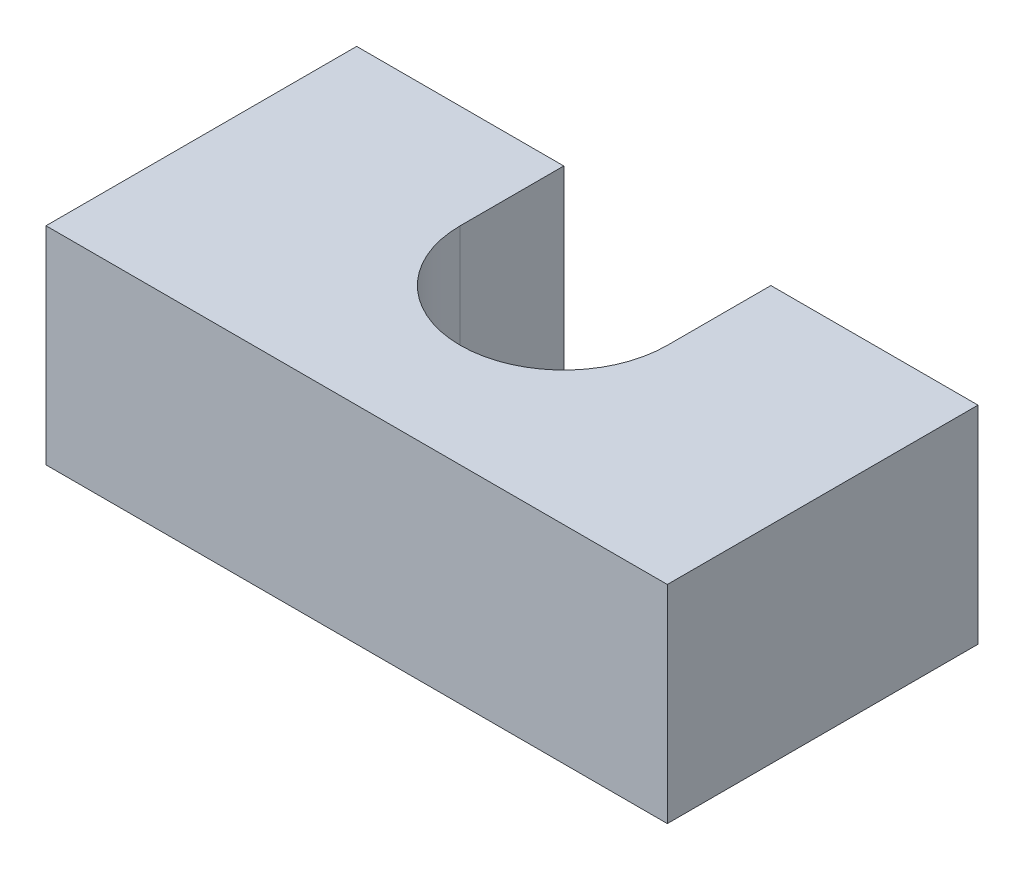
from build123d import *

# Parameters (mm, degrees)
BOSS_EXTRUDE1_DEPTH = 20


with BuildPart() as part:
    # Sketch2 → Boss-Extrude1 (new body)
    with BuildSketch(Plane(origin=(0, 0, 0), x_dir=(1, 0, 0), z_dir=(0, 1, 0))):
        with BuildLine():
            Line((-10, 0), (-10, -10))
            ThreePointArc((-10, -10), (0, -20), (10, -10))
            Line((10, -10), (10, 0))
            Line((10, 0), (30, 0))
            Line((30, 0), (30, -30))
            Line((30, -30), (-30, -30))
            Line((-30, -30), (-30, 0))
            Line((-30, 0), (-10, 0))
        make_face()
    extrude(amount=BOSS_EXTRUDE1_DEPTH)


solid = part.part
